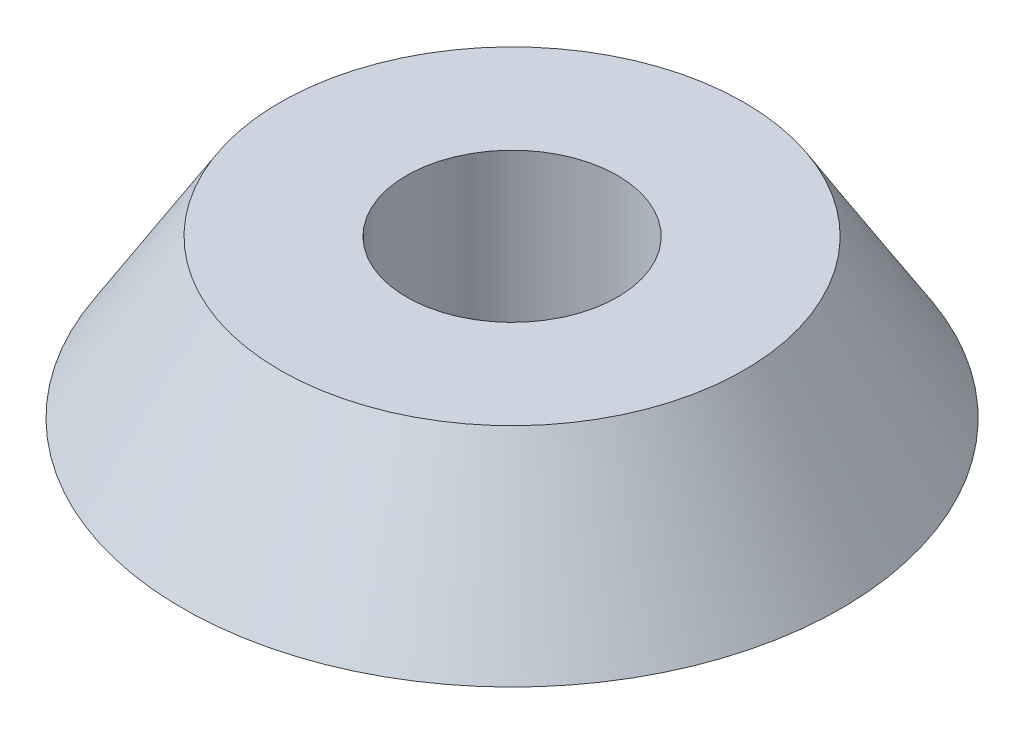
from build123d import *

# Parameters (mm, degrees)
CUT_EXTRUDE_START   = -0.15
SKETCH_2_R          = 10.25
SKETCH_2_R_2        = 3.25
CUT_EXTRUDE_1_DEPTH = 0.15


with BuildPart() as part:
    # 草图1 → 旋转1 (revolve)
    with BuildSketch(Plane.XY, mode=Mode.PRIVATE) as revolve_1_sk:
        Polygon((3.25, 0), (3.25, 5), (7.15, 5), (10.25, 0), align=None)
    revolve(revolve_1_sk.sketch.rotate(Axis((0, 0, 0), (0, 1, 0)), 90), axis=Axis((0, 0, 0), (0, 1, 0)))

    # 草图2 → 切除-拉伸1 (cut)
    with BuildSketch(Plane.XZ.offset(CUT_EXTRUDE_START)):
        Circle(SKETCH_2_R)
        with Locations(Location((0, 0, 0), (0, 0, 270))):
            Circle(SKETCH_2_R_2, mode=Mode.SUBTRACT)
    extrude(amount=CUT_EXTRUDE_1_DEPTH, mode=Mode.SUBTRACT)


solid = part.part
